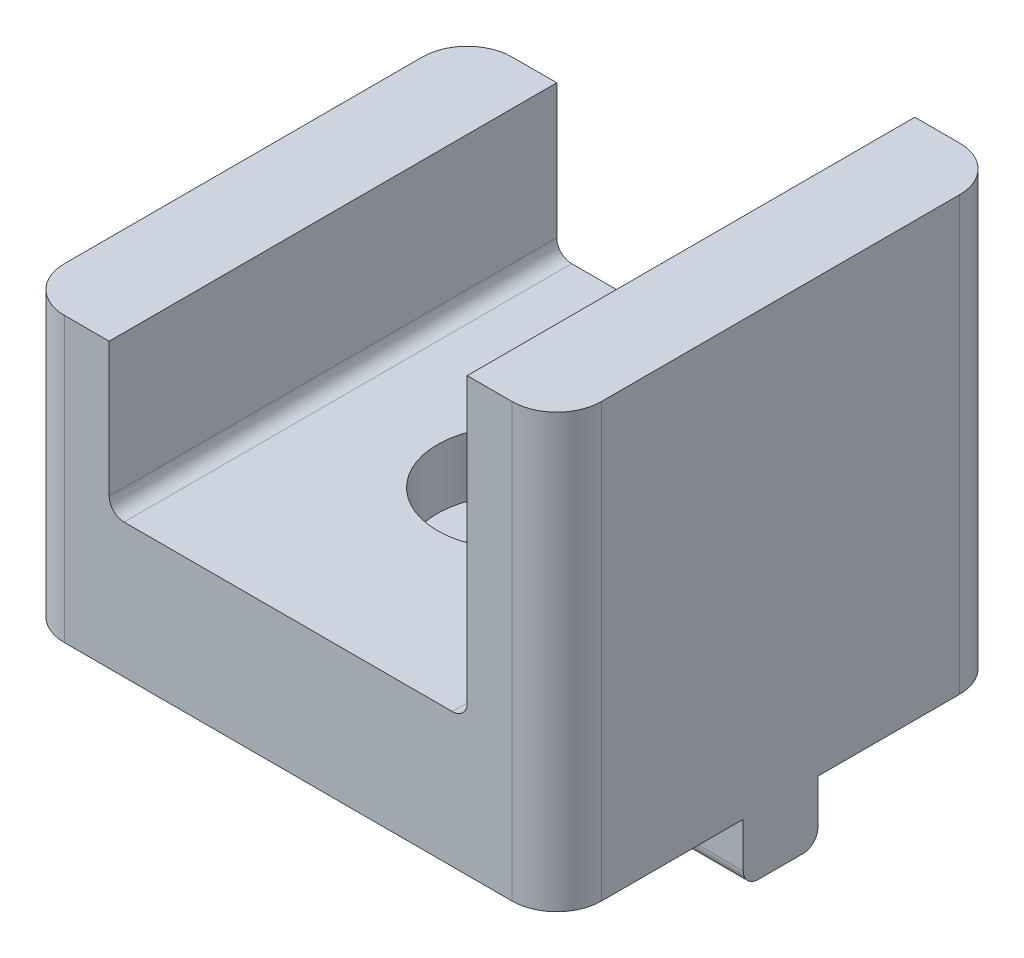
from build123d import *

# Parameters (mm, degrees)
SKETCH1_W           = 24
SKETCH1_H           = 9
BOSS_EXTRUDE1_DEPTH = 30
FILLET1_R           = 1
FILLET2_R           = 3
SKETCH3_R           = 2.5
CUT_EXTRUDE2_DEPTH  = 10
SKETCH4_R           = 5
CUT_EXTRUDE3_DEPTH  = 4
SKETCH5_W           = 8
SKETCH5_H           = 5
BOSS_EXTRUDE2_DEPTH = 4
FILLET3_R           = 1


with BuildPart() as part:
    # Sketch1 → Boss-Extrude1 (new body)
    with BuildSketch(Plane.XY):
        Polygon((-18, -4.5), (-12, -4.5), (-12, 4.5), (-12, 14.5), (-18, 14.5), align=None)
        Rectangle(SKETCH1_W, SKETCH1_H)
        Polygon((12, 4.5), (12, -4.5), (18, -4.5), (18, 24.5), (12, 24.5), align=None)
    extrude(amount=BOSS_EXTRUDE1_DEPTH)

    # Fillet1
    fillet1_edges = [part.edges().sort_by_distance(p)[0] for p in [
        (-12, 4.5, 15),
        (12, 4.5, 15),
    ]]
    fillet(fillet1_edges, radius=FILLET1_R)

    # Fillet2
    fillet2_edges = [part.edges().sort_by_distance(p)[0] for p in [
        (18, 10, 0),
        (-18, 5, 0),
        (18, 10, 30),
        (-18, 5, 30),
    ]]
    fillet(fillet2_edges, radius=FILLET2_R)

    # Sketch3 → Cut-Extrude2 (cut)
    with BuildSketch(Plane(origin=(0, 4.5, 0), x_dir=(1, 0, 0), z_dir=(0, 1, 0))):
        with Locations(Location((0, -15, 0), (0, 0, 270))):
            Circle(SKETCH3_R)
    extrude(amount=-CUT_EXTRUDE2_DEPTH, mode=Mode.SUBTRACT)

    # Sketch4 → Cut-Extrude3 (cut)
    with BuildSketch(Plane(origin=(0, 4.5, 0), x_dir=(1, 0, 0), z_dir=(0, 1, 0))):
        with Locations(Location((0, -15, 0), (0, 0, 270))):
            Circle(SKETCH4_R)
    extrude(amount=-CUT_EXTRUDE3_DEPTH, mode=Mode.SUBTRACT)

    # Sketch5 → Boss-Extrude2 (add)
    with BuildSketch(Plane.XZ.offset(4.5)):
        with Locations((-14, 15)):
            Rectangle(SKETCH5_W, SKETCH5_H)
        with Locations((14, 15)):
            Rectangle(SKETCH5_W, SKETCH5_H)
    extrude(amount=BOSS_EXTRUDE2_DEPTH)

    # Fillet3
    fillet3_edges = [part.edges().sort_by_distance(p)[0] for p in [
        (14, -8.5, 17.5),
        (14, -8.5, 12.5),
        (-14, -8.5, 12.5),
        (-14, -8.5, 17.5),
    ]]
    fillet(fillet3_edges, radius=FILLET3_R)


solid = part.part
